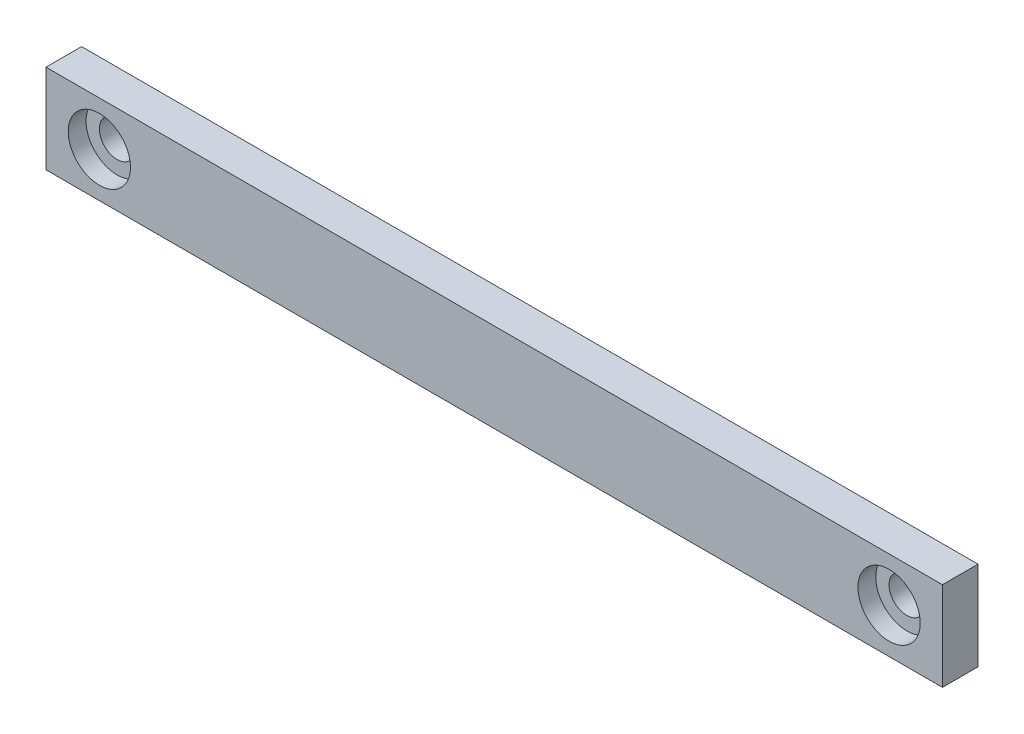
from build123d import *

# Parameters (mm, degrees)
SKETCH_1_W          = 50.4
SKETCH_1_H          = 5
SKETCH_1_R          = 1
EXTRUDE_1_DEPTH     = 2
CUT_EXTRUDE_START   = 2
SKETCH_1_8_R        = 1.75
CUT_EXTRUDE_2_DEPTH = 1


with BuildPart() as part:
    # 草图1 → 凸台-拉伸1 (new body)
    with BuildSketch(Plane.XY):
        with Locations((25.2, -2.5)):
            Rectangle(SKETCH_1_W, SKETCH_1_H)
        with Locations((3, -2.5)):
            Circle(SKETCH_1_R, mode=Mode.SUBTRACT)
        with Locations((47.4, -2.5)):
            Circle(SKETCH_1_R, mode=Mode.SUBTRACT)
    extrude(amount=EXTRUDE_1_DEPTH)

    # 草图1<8> → 切除-拉伸2 (cut)
    with BuildSketch(Plane.XY.offset(CUT_EXTRUDE_START)):
        with Locations(Location((3, -2.5, 0), (0, 0, 180))):
            Circle(SKETCH_1_8_R)
        with Locations(Location((47.4, -2.5, 0), (0, 0, 180))):
            Circle(SKETCH_1_8_R)
    extrude(amount=-CUT_EXTRUDE_2_DEPTH, mode=Mode.SUBTRACT)


solid = part.part
